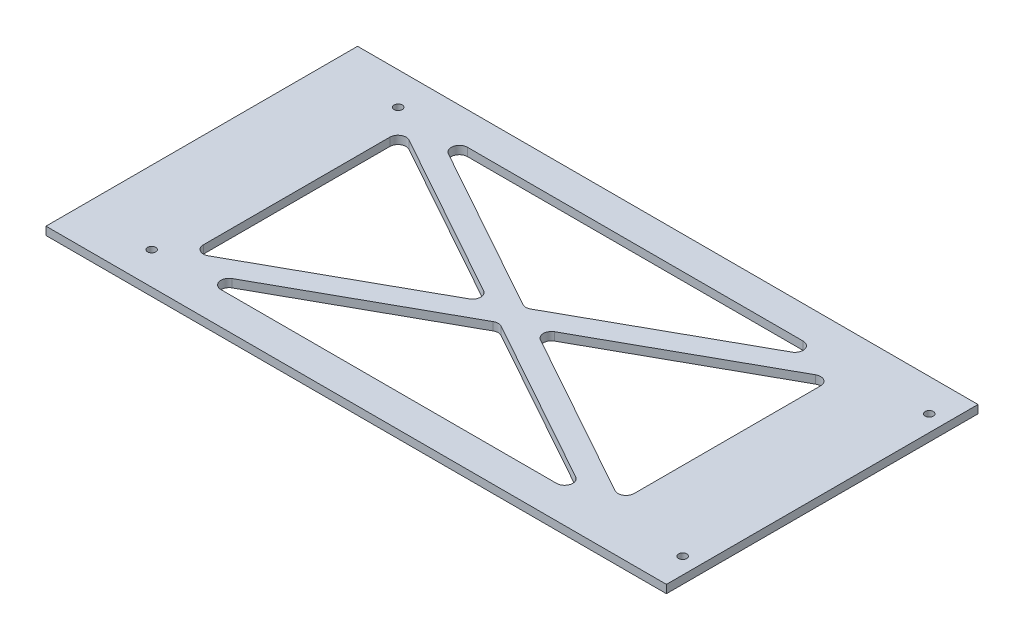
from build123d import *

# Parameters (mm, degrees)
SKETCH_1_W      = 229
SKETCH_1_H      = 115
SKETCH_1_R      = 1.5
EXTRUDE_6_DEPTH = 3


with BuildPart() as part:
    # 草图1 → 凸台-拉伸6 (new body)
    with BuildSketch(Plane(origin=(0, 0, 0), x_dir=(1, 0, 0), z_dir=(0, 1, 0))):
        with Locations((113.28975623, -22.19835875)):
            Rectangle(SKETCH_1_W, SKETCH_1_H)
        with Locations(Location((25.78975623, 23.30164125, 0), (0, 0, 270))):
            Circle(SKETCH_1_R, mode=Mode.SUBTRACT)
        with Locations(Location((25.78975623, -67.69835875, 0), (0, 0, 270))):
            Circle(SKETCH_1_R, mode=Mode.SUBTRACT)
        with Locations(Location((221.78975623, 23.30164125, 0), (0, 0, 270))):
            Circle(SKETCH_1_R, mode=Mode.SUBTRACT)
        with Locations(Location((221.78975623, -67.69835875, 0), (0, 0, 270))):
            Circle(SKETCH_1_R, mode=Mode.SUBTRACT)
        with BuildLine():
            Line((49.910205521, 17.679169422), (111.832827436, -16.722287198))
            ThreePointArc((111.832827436, -16.722287198), (113.28975623, -17.099815369), (114.746685023, -16.722287198))
            Line((114.746685023, -16.722287198), (176.669306939, 17.679169422))
            ThreePointArc((176.669306939, 17.679169422), (178.11646281, 21.054165175), (175.212378145, 23.30164125))
            Line((175.212378145, 23.30164125), (51.367134314, 23.30164125))
            ThreePointArc((51.367134314, 23.30164125), (48.463049649, 21.054165175), (49.910205521, 17.679169422))
        make_face(mode=Mode.SUBTRACT)
        with BuildLine():
            Line((192.78975623, 12.20309787), (192.78975623, -56.599815369))
            ThreePointArc((192.78975623, -56.599815369), (191.311139419, -59.185428099), (188.332827436, -59.222287198))
            Line((188.332827436, -59.222287198), (126.410205521, -24.820830578))
            ThreePointArc((126.410205521, -24.820830578), (124.867134314, -22.19835875), (126.410205521, -19.575886921))
            Line((126.410205521, -19.575886921), (188.332827436, 14.825569699))
            ThreePointArc((188.332827436, 14.825569699), (191.311139419, 14.7887106), (192.78975623, 12.20309787))
        make_face(mode=Mode.SUBTRACT)
        with BuildLine():
            Line((114.746685023, -27.674430301), (176.669306939, -62.075886921))
            ThreePointArc((176.669306939, -62.075886921), (178.11646281, -65.450882674), (175.212378145, -67.69835875))
            Line((175.212378145, -67.69835875), (51.367134314, -67.69835875))
            ThreePointArc((51.367134314, -67.69835875), (48.463049649, -65.450882674), (49.910205521, -62.075886921))
            Line((49.910205521, -62.075886921), (111.832827436, -27.674430301))
            ThreePointArc((111.832827436, -27.674430301), (113.28975623, -27.29690213), (114.746685023, -27.674430301))
        make_face(mode=Mode.SUBTRACT)
        with BuildLine():
            Line((100.169306939, -19.575886921), (38.246685023, 14.825569699))
            ThreePointArc((38.246685023, 14.825569699), (35.26837304, 14.7887106), (33.78975623, 12.20309787))
            Line((33.78975623, 12.20309787), (33.78975623, -56.599815369))
            ThreePointArc((33.78975623, -56.599815369), (35.26837304, -59.185428099), (38.246685023, -59.222287198))
            Line((38.246685023, -59.222287198), (100.169306939, -24.820830578))
            ThreePointArc((100.169306939, -24.820830578), (101.712378145, -22.19835875), (100.169306939, -19.575886921))
        make_face(mode=Mode.SUBTRACT)
    extrude(amount=EXTRUDE_6_DEPTH)


solid = part.part
